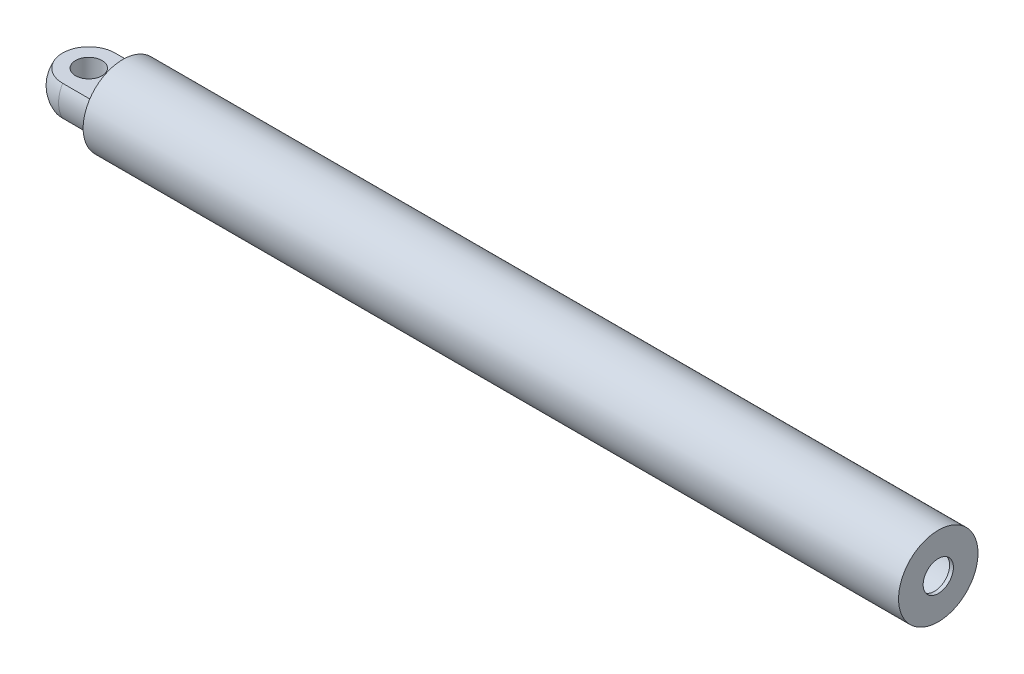
from build123d import *

# Parameters (mm, degrees)
SKETCH_3_W           = 88.479839294
SKETCH_3_H           = 156.072634557
CUT_EXTRUDE_1_DEPTH  = 112
EXTRUDE_3_DEPTH      = 90
SKETCH_5_R           = 35
CUT_EXTRUDE_2_DEPTH  = 145.568322948
SKETCH_6_R           = 105
EXTRUDE_4_DEPTH      = 25
SKETCH_7_R           = 105
SKETCH_7_R_2         = 90
EXTRUDE_5_DEPTH      = 2130
EXTRUDE_START        = -10
SKETCH_8_R           = 90
SKETCH_8_R_2         = 40
EXTRUDE_6_DEPTH      = 10
SKETCH_9_R           = 13.5
EXTRUDE_7_DEPTH      = 31
EXTRUDE_7_2_DEPTH    = 31
SKETCH_10_W          = 75
SKETCH_10_H          = 30
EXTRUDE_8_DEPTH      = 40
SKETCH_11_R          = 8
SKETCH_11_R_2        = 5.5
EXTRUDE_9_DEPTH      = 1855
SKETCH_12_R          = 8
SKETCH_12_R_2        = 5.5
EXTRUDE_10_DEPTH     = 95
M18X1_5_1_AT_2_COUNT = 2
M18X1_5_1_AT_2_PITCH = 40


with BuildPart() as part:
    # 草图1 → 旋转1 (revolve)
    with BuildSketch(Plane.XY, mode=Mode.PRIVATE) as revolve_1_sk:
        with BuildLine():
            Line((35, -40), (35, 40))
            Line((35, 40), (69.282032303, 40))
            ThreePointArc((69.282032303, 40), (80, 0), (69.282032303, -40))
            Line((69.282032303, -40), (35, -40))
        make_face()
    revolve(revolve_1_sk.sketch.rotate(Axis((0, 0, 0), (0, 1, 0)), 90), axis=Axis((0, 0, 0), (0, 1, 0)))

    # 草图3 → 切除-拉伸1 (cut)
    with BuildSketch(Plane(origin=(0, 40, 0), x_dir=(1, 0, 0), z_dir=(0, 1, 0))):
        with Locations((44.239919647, 8.27055624)):
            Rectangle(SKETCH_3_W, SKETCH_3_H)
    extrude(amount=-CUT_EXTRUDE_1_DEPTH, mode=Mode.SUBTRACT)

    # 草图4 → 凸台-拉伸3 (add)
    with BuildSketch(Plane(origin=(0, 0, 0), x_dir=(0, 0, -1), z_dir=(1, 0, 0))):
        with BuildLine():
            Line((-69.282032303, 40), (69.282032303, 40))
            ThreePointArc((69.282032303, 40), (80, 0), (69.282032303, -40))
            Line((69.282032303, -40), (-69.282032303, -40))
            ThreePointArc((-69.282032303, -40), (-80, 0), (-69.282032303, 40))
        make_face()
    extrude(amount=EXTRUDE_3_DEPTH)

    # 草图5 → 切除-拉伸2 (cut, through all)
    with BuildSketch(Plane(origin=(0, 40, 0), x_dir=(1, 0, 0), z_dir=(0, 1, 0))):
        with Locations(Location((0, 0, 0), (0, 0, 90))):
            Circle(SKETCH_5_R)
    extrude(amount=-CUT_EXTRUDE_2_DEPTH, mode=Mode.SUBTRACT)

    # 草图6 → 凸台-拉伸4 (add)
    with BuildSketch(Plane(origin=(90, 0, 0), x_dir=(0, 0, -1), z_dir=(1, 0, 0))):
        Circle(SKETCH_6_R)
    extrude(amount=EXTRUDE_4_DEPTH)

    # 草图7 → 凸台-拉伸5 (add)
    with BuildSketch(Plane(origin=(115, 0, 0), x_dir=(0, 0, -1), z_dir=(1, 0, 0))):
        Circle(SKETCH_7_R)
        Circle(SKETCH_7_R_2, mode=Mode.SUBTRACT)
    extrude(amount=EXTRUDE_5_DEPTH)

    # 草图8 → 凸台-拉伸6 (add)
    with BuildSketch(Plane(origin=(2245, 0, 0), x_dir=(0, 0, -1), z_dir=(1, 0, 0)).offset(EXTRUDE_START)):
        Circle(SKETCH_8_R)
        Circle(SKETCH_8_R_2, mode=Mode.SUBTRACT)
    extrude(amount=EXTRUDE_6_DEPTH)


with BuildPart() as body_2:
    # 草图9 → 凸台-拉伸7 (new body)
    with BuildSketch(Plane(origin=(0, 0, -90), x_dir=(-1, 0, 0), z_dir=(0, 0, -1))):
        with Locations((-2150, 0)):
            Circle(SKETCH_9_R)
    extrude(amount=EXTRUDE_7_DEPTH)



with BuildPart() as body_3:
    # 草图9 → Extrude 7 2 (new body)
    with BuildSketch(Plane(origin=(0, 0, -90), x_dir=(-1, 0, 0), z_dir=(0, 0, -1))):
        with Locations((-125, 0)):
            Circle(SKETCH_9_R)
    extrude(amount=EXTRUDE_7_2_DEPTH)



with BuildPart() as body_4:
    # 草图10 → 凸台-拉伸8 (new body)
    with BuildSketch(Plane(origin=(0, 0, -90), x_dir=(-1, 0, 0), z_dir=(0, 0, -1))):
        with Locations((-257.5, 0)):
            Rectangle(SKETCH_10_W, SKETCH_10_H)
    extrude(amount=EXTRUDE_8_DEPTH)


with BuildPart() as body_2_1:
    add(body_2.part)

    add(body_4.part)  # 凸台-拉伸9 merges body 4
    # 草图11 → 凸台-拉伸9 (add)
    with BuildSketch(Plane(origin=(2150, 0, 0), x_dir=(0, 0, -1), z_dir=(1, 0, 0))):
        with Locations(Location((110, 0, 0), (0, 0, 180))):
            Circle(SKETCH_11_R)
        with Locations((110, 0)):
            Circle(SKETCH_11_R_2, mode=Mode.SUBTRACT)
    extrude(amount=-EXTRUDE_9_DEPTH)


with BuildPart() as body_3_1:
    add(body_3.part)

    add(body_2_1.part)  # 凸台-拉伸10 merges body 2
    # 草图12 → 凸台-拉伸10 (add)
    with BuildSketch(Plane(origin=(125, 0, 0), x_dir=(0, 0, -1), z_dir=(1, 0, 0))):
        with Locations((110, 0)):
            Circle(SKETCH_12_R)
        with Locations((110, 0)):
            Circle(SKETCH_12_R_2, mode=Mode.SUBTRACT)
    extrude(amount=EXTRUDE_10_DEPTH)

    # 草图14 → M18x1.5 螺纹孔1 (revolve, cut)
    with BuildSketch(Plane(origin=(277.5, 0, -130), x_dir=(0, 1, 0), z_dir=(1, 0, 0))):
        Polygon((0, 0), (0, 39.957100107), (8.25, 35), (8.25, 0), align=None)
    m18x1_5_1 = revolve(axis=Axis((277.5, 0, -136.35), (0, 0, 1)), mode=Mode.SUBTRACT)

    # M18x1.5 螺纹孔1 at 2: M18x1.5 螺纹孔1 ×2
    with Locations(*[(-i * M18X1_5_1_AT_2_PITCH, 0, 0) for i in range(1, M18X1_5_1_AT_2_COUNT)]):
        add(m18x1_5_1, mode=Mode.SUBTRACT)


solid = Compound([part.part, body_3_1.part])
